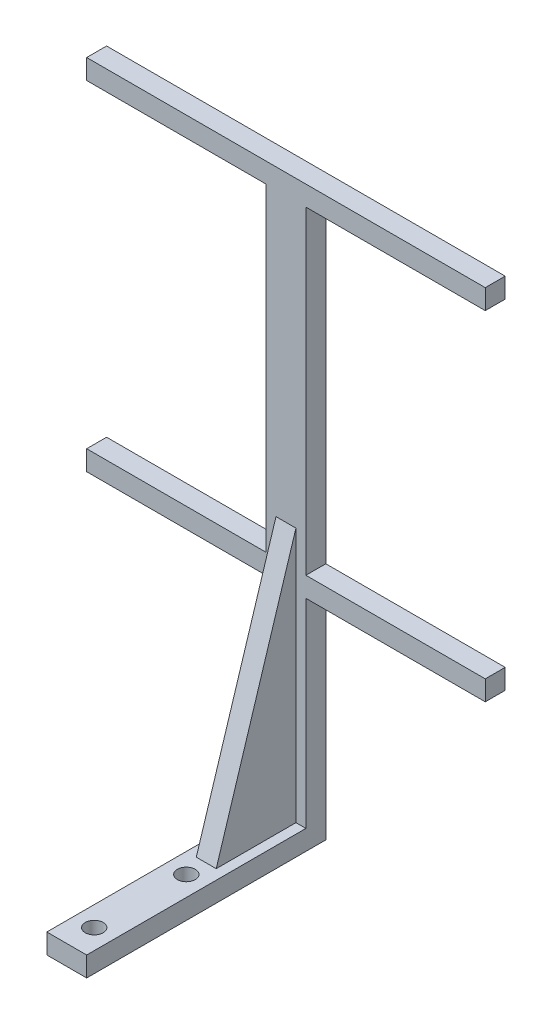
from build123d import *

# Parameters (mm, degrees)
SKETCH1_W               = 10
SKETCH1_H               = 60
BOSS_EXTRUDE1_DEPTH     = 5
SKETCH2_W               = 10
SKETCH2_H               = 5
BOSS_EXTRUDE2_DEPTH     = 140
RIB1_REACH              = 150.155
SKETCH3_WALL_W          = 365.362866258
SKETCH3_WALL_H          = 5
SKETCH4_W               = 100
SKETCH4_H               = 5
BOSS_EXTRUDE3_DEPTH     = 5
CUT_EXTRUDE1_DEPTH      = 152.657508881
CUT_EXTRUDE1_DEPTH_BACK = 152.657508881
SKETCH6_R               = 2.25


with BuildPart() as part:
    # Sketch1 → Boss-Extrude1 (new body)
    with BuildSketch(Plane(origin=(0, 0, 0), x_dir=(1, 0, 0), z_dir=(0, 1, 0))):
        Rectangle(SKETCH1_W, SKETCH1_H)
    extrude(amount=BOSS_EXTRUDE1_DEPTH)

    # Sketch2 → Boss-Extrude2 (add)
    with BuildSketch(Plane(origin=(0, 5, 0), x_dir=(1, 0, 0), z_dir=(0, 1, 0))):
        with Locations((0, 27.5)):
            Rectangle(SKETCH2_W, SKETCH2_H)
    extrude(amount=BOSS_EXTRUDE2_DEPTH)

    # Sketch3 wall → Rib1 (add, up to next)
    with BuildSketch(Plane(origin=(0, 37, -15), x_dir=(0, 0.954479978035, -0.298274993136), z_dir=(0, 0.298274993136, 0.954479978035)), mode=Mode.PRIVATE) as rib1_sk1:
        Rectangle(SKETCH3_WALL_W, SKETCH3_WALL_H)
    rib1_tool1 = extrude(rib1_sk1.sketch, amount=-RIB1_REACH, mode=Mode.PRIVATE) - part.part
    add(rib1_tool1.solids().sort_by_distance((0, 37, -15))[0])

    # Sketch4 → Boss-Extrude3 (add)
    with BuildSketch(Plane.XY.offset(-25)):
        with Locations((0, 142.5)):
            Rectangle(SKETCH4_W, SKETCH4_H)
        with Locations((0, 57.5)):
            Rectangle(SKETCH4_W, SKETCH4_H)
    extrude(amount=-BOSS_EXTRUDE3_DEPTH)

    # Sketch6 → Cut-Extrude1 (cut, two sides: drawn at the far end of the back side and taken through both)
    with BuildSketch(Plane(origin=(0, 5, 0), x_dir=(1, 0, 0), z_dir=(0, 1, 0)).offset(-CUT_EXTRUDE1_DEPTH_BACK)):
        with Locations(Location((0, 0, 0), (0, 0, 270))):
            Circle(SKETCH6_R)
        with Locations(Location((0, -23.103193392, 0), (0, 0, 270))):
            Circle(SKETCH6_R)
    extrude(amount=CUT_EXTRUDE1_DEPTH + CUT_EXTRUDE1_DEPTH_BACK, mode=Mode.SUBTRACT)


solid = part.part
